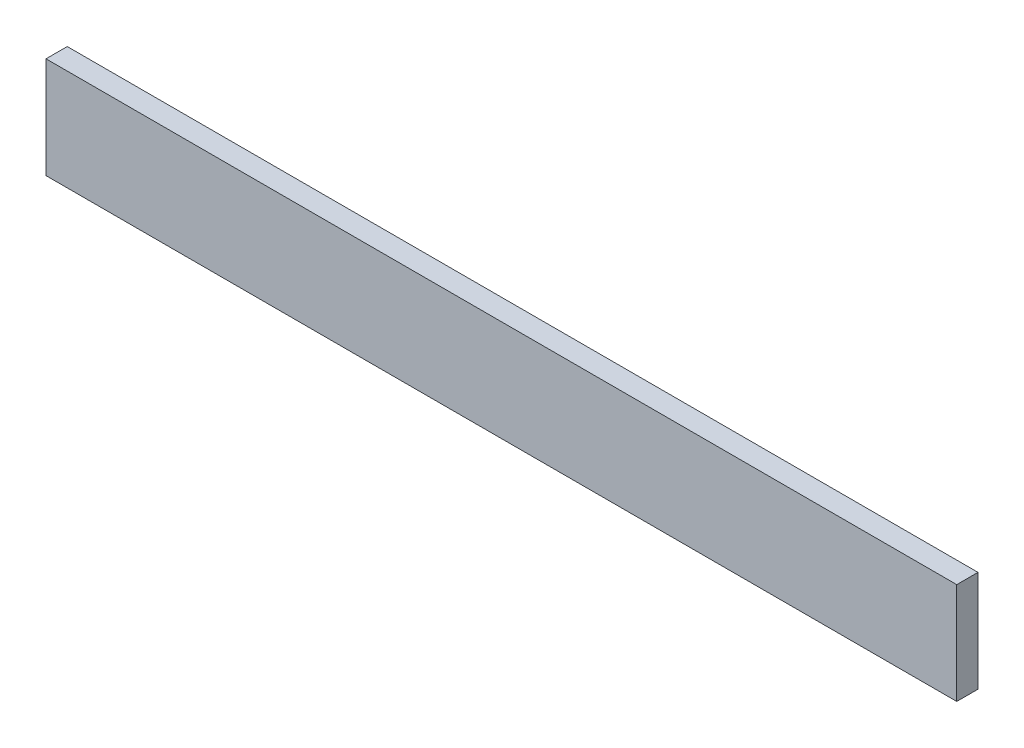
from build123d import *

# Parameters (mm, degrees)
SKETCH1_W           = 228.6
SKETCH1_H           = 25.4
BOSS_EXTRUDE1_DEPTH = 5.334


with BuildPart() as part:
    # Sketch1 → Boss-Extrude1 (new body)
    with BuildSketch(Plane.XY):
        with Locations((-114.3, -7.902175444)):
            Rectangle(SKETCH1_W, SKETCH1_H)
    extrude(amount=BOSS_EXTRUDE1_DEPTH)


solid = part.part
